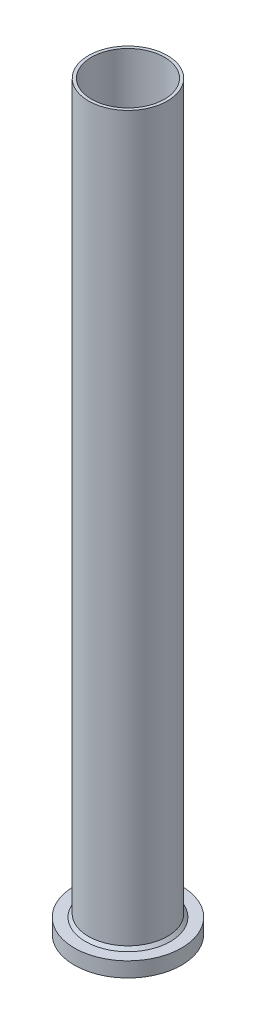
from build123d import *

# Parameters (mm, degrees)
SKETCH1_R           = 18
BOSS_EXTRUDE1_DEPTH = 4
SKETCH2_R           = 13.25
SKETCH2_R_2         = 12.25
BOSS_EXTRUDE2_DEPTH = 245
SKETCH3_R           = 18
SKETCH3_R_2         = 12.25
BOSS_EXTRUDE3_DEPTH = 1
CHAMFER1_SIZE       = 1


with BuildPart() as part:
    # Sketch1 → Boss-Extrude1 (new body)
    with BuildSketch(Plane(origin=(0, 0, 0), x_dir=(1, 0, 0), z_dir=(0, 1, 0))):
        with Locations(Location((0, 0, 0), (0, 0, 270))):
            Circle(SKETCH1_R)
        Polygon((8.082903769, -14), (16.165807537, 0), (8.082903769, 14), (-8.082903769, 14), (-16.165807537, 0), (-8.082903769, -14), align=None, mode=Mode.SUBTRACT)
    extrude(amount=BOSS_EXTRUDE1_DEPTH)



with BuildPart() as body_2:
    # Sketch2 → Boss-Extrude2 (new body)
    with BuildSketch(Plane(origin=(0, 4, 0), x_dir=(1, 0, 0), z_dir=(0, 1, 0))):
        with Locations(Location((0, 0, 0), (0, 0, 270))):
            Circle(SKETCH2_R)
        with Locations(Location((0, 0, 0), (0, 0, 270))):
            Circle(SKETCH2_R_2, mode=Mode.SUBTRACT)
    extrude(amount=BOSS_EXTRUDE2_DEPTH)


with BuildPart() as part_1:
    add(part.part)

    add(body_2.part)  # Boss-Extrude3 merges body 2
    # Sketch3 → Boss-Extrude3 (add)
    with BuildSketch(Plane(origin=(0, 4, 0), x_dir=(1, 0, 0), z_dir=(0, 1, 0))):
        with Locations(Location((0, 0, 0), (0, 0, 270))):
            Circle(SKETCH3_R)
        with Locations(Location((0, 0, 0), (0, 0, 270))):
            Circle(SKETCH3_R_2, mode=Mode.SUBTRACT)
    extrude(amount=BOSS_EXTRUDE3_DEPTH)

    # Chamfer1
    chamfer1_edges = [part_1.edges().sort_by_distance(p)[0] for p in [
        (0, 5, -13.25),
    ]]
    chamfer(chamfer1_edges, length=CHAMFER1_SIZE)


solid = part_1.part
